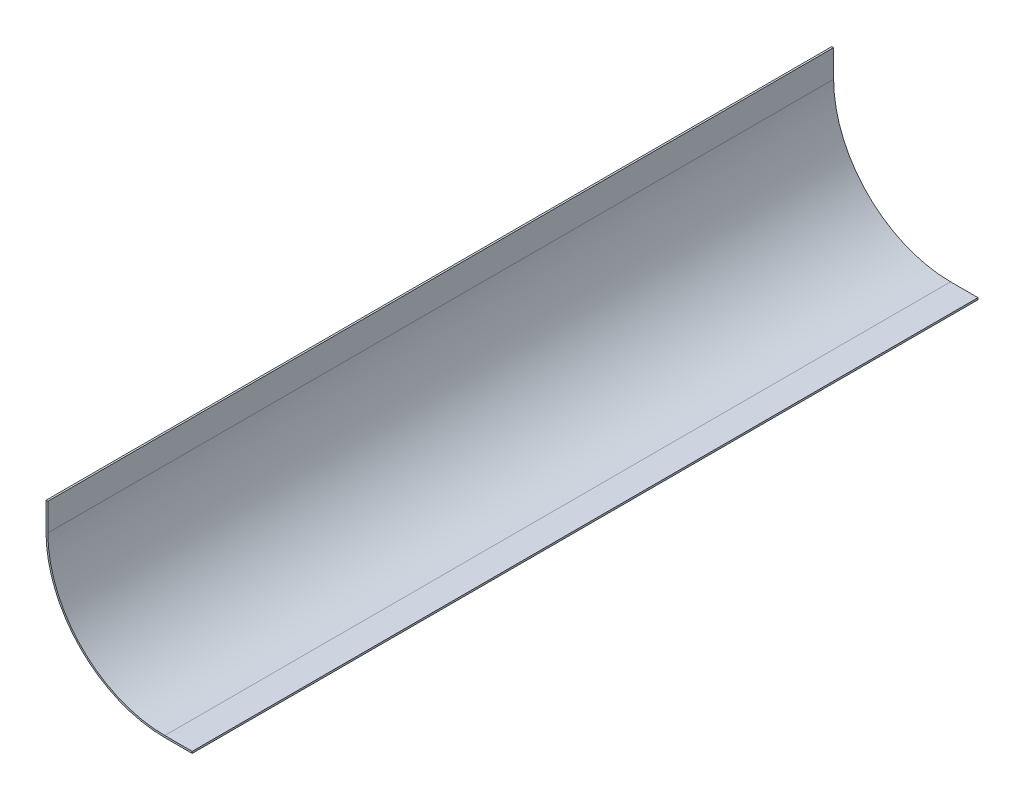
from build123d import *

# Parameters (mm, degrees)
BOSS_EXTRUDE4_DEPTH = 430


with BuildPart() as part:
    # Sketch3 → Boss-Extrude4 (new body)
    with BuildSketch(Plane.XY):
        with BuildLine():
            Line((-99.81981982, 73.333333333), (-99.81981982, 58.333333333))
            ThreePointArc((-99.81981982, 58.333333333), (-80.781760597, 12.371392556), (-34.81981982, -6.666666667))
            Line((-34.81981982, -6.666666667), (-19.81981982, -6.666666667))
            Line((-19.81981982, -6.666666667), (-19.81981982, -5.666666667))
            Line((-19.81981982, -5.666666667), (-34.81981982, -5.666666667))
            ThreePointArc((-34.81981982, -5.666666667), (-80.074653816, 13.078499337), (-98.81981982, 58.333333333))
            Line((-98.81981982, 58.333333333), (-98.81981982, 73.333333333))
            Line((-98.81981982, 73.333333333), (-99.81981982, 73.333333333))
        make_face()
    extrude(amount=BOSS_EXTRUDE4_DEPTH)


solid = part.part
